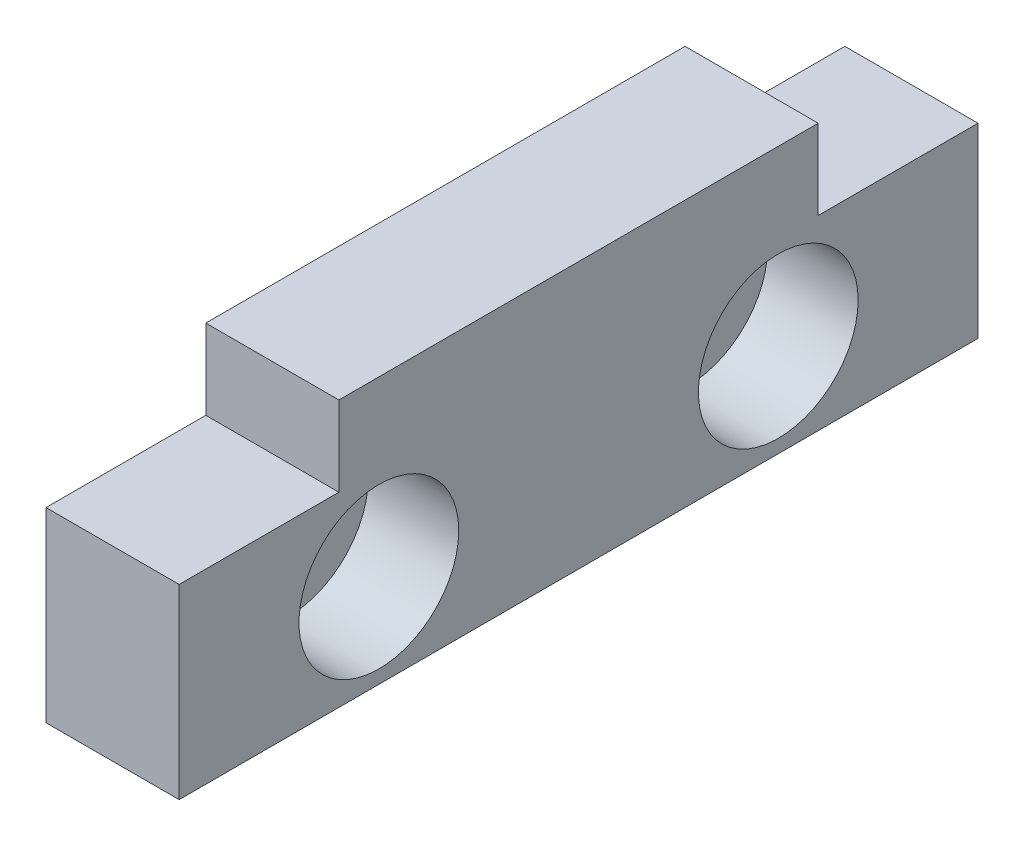
from build123d import *

# Parameters (mm, degrees)
SKETCH_1_W                = 30
SKETCH_1_H                = 10
EXTRUDE_1_DEPTH           = 5
SKETCH_4_W                = 6
SKETCH_4_H                = 3
CUT_EXTRUDE_1_DEPTH       = 17.583123952
HOLE_WIZARD_1_D           = 3.4
HOLE_WIZARD_1_CBORE_D     = 6
HOLE_WIZARD_1_CBORE_DEPTH = 3.4


with BuildPart() as part:
    # 草图1 → 凸台-拉伸1 (new body)
    with BuildSketch(Plane(origin=(0, 0, 0), x_dir=(0, 0, -1), z_dir=(1, 0, 0))):
        Rectangle(SKETCH_1_W, SKETCH_1_H)
    extrude(amount=EXTRUDE_1_DEPTH)

    # 草图4 → 切除-拉伸1 (cut, through all)
    with BuildSketch(Plane(origin=(5, 0, 0), x_dir=(0, 0, -1), z_dir=(1, 0, 0))):
        with Locations((12, 3.5)):
            Rectangle(SKETCH_4_W, SKETCH_4_H)
        with Locations((-12, 3.5)):
            Rectangle(SKETCH_4_W, SKETCH_4_H)
    extrude(amount=-CUT_EXTRUDE_1_DEPTH, mode=Mode.SUBTRACT)

    # 打孔尺寸根据内六角圆柱头螺钉的类型1 (through all)
    with Locations(Plane(origin=(5, 0, 0), x_dir=(0, 0, -1), z_dir=(1, 0, 0))):
        with Locations((-7.5, -1.5), (7.5, -1.5)):
            CounterBoreHole(HOLE_WIZARD_1_D / 2, HOLE_WIZARD_1_CBORE_D / 2, HOLE_WIZARD_1_CBORE_DEPTH)


solid = part.part
